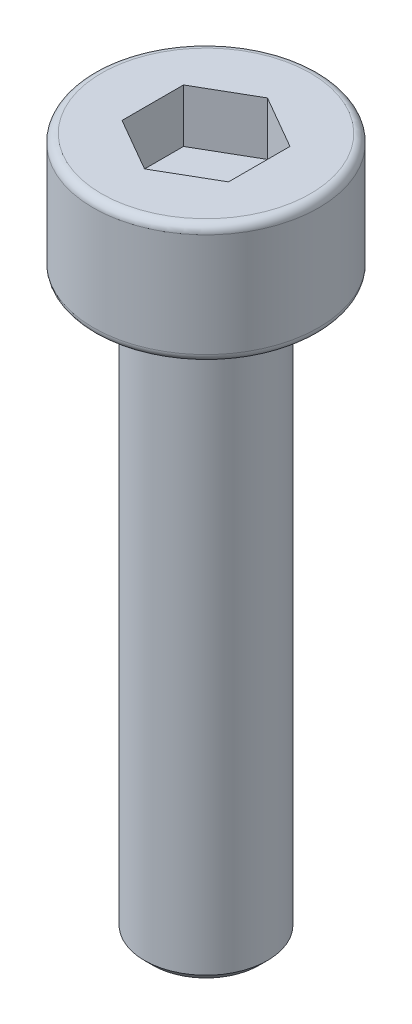
from build123d import *

# Parameters (mm, degrees)
CUT_EXTRUDE_1_DEPTH = 1.3
FILLET_1_R          = 0.2
CHAMFER_1_SIZE      = 0.2


with BuildPart() as part:
    # 草图1 → 旋转1 (revolve)
    with BuildSketch(Plane.XY, mode=Mode.PRIVATE) as revolve_1_sk:
        Polygon((0, 0), (2.75, 0), (2.75, -2.93), (1.5, -2.93), (1.5, -16.93), (0, -16.93), align=None)
    revolve(revolve_1_sk.sketch.rotate(Axis((0, 0, 0), (0, -1, 0)), 90), axis=Axis((0, 0, 0), (0, -1, 0)))

    # 草图2 → 切除-拉伸1 (cut)
    with BuildSketch(Plane(origin=(0, 0, 0), x_dir=(1, 0, 0), z_dir=(0, 1, 0))):
        Polygon((0, 1.5), (-1.299038106, 0.75), (-1.299038106, -0.75), (0, -1.5), (1.299038106, -0.75), (1.299038106, 0.75), align=None)
    extrude(amount=-CUT_EXTRUDE_1_DEPTH, mode=Mode.SUBTRACT)

    # 圆角1
    fillet_1_edges = [part.edges().sort_by_distance(p)[0] for p in [
        (0, -2.93, -2.75),
        (0, 0, -2.75),
    ]]
    fillet(fillet_1_edges, radius=FILLET_1_R)

    # 倒角1
    chamfer_1_edges = [part.edges().sort_by_distance(p)[0] for p in [
        (0, -16.93, -1.5),
    ]]
    chamfer(chamfer_1_edges, length=CHAMFER_1_SIZE)


solid = part.part
